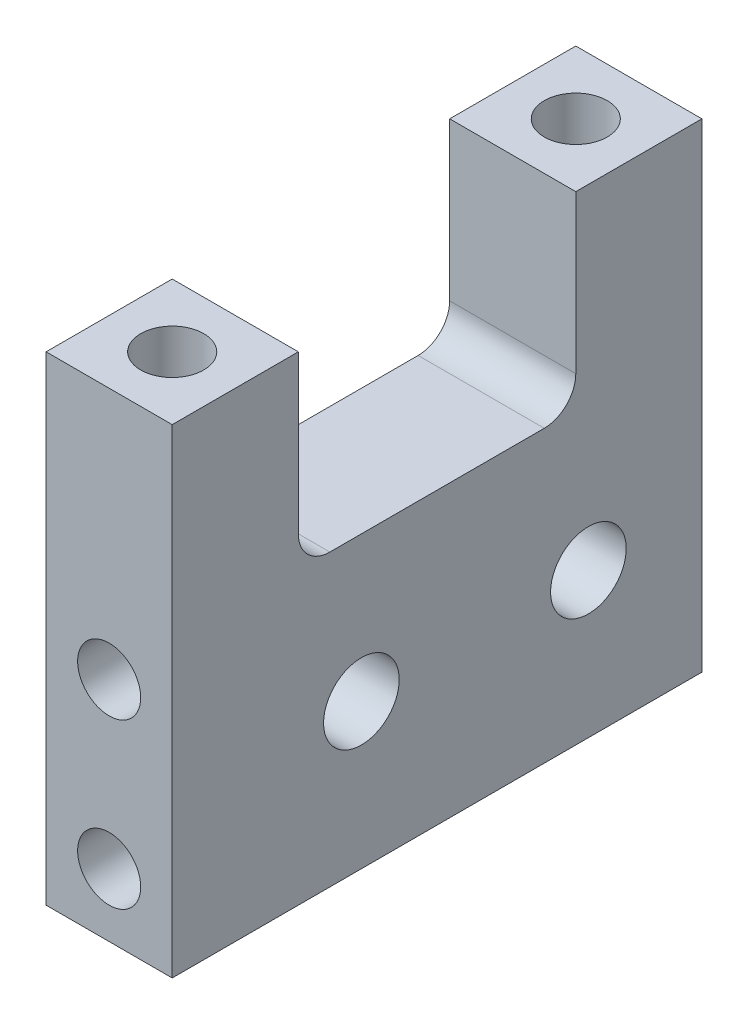
from build123d import *

# Parameters (mm, degrees)
ESQUISSE1_W           = 42
ESQUISSE1_H           = 38
EXTRUSION1_DEPTH      = 10
ESQUISSE2_R           = 2.5
EXTRUSION3_DEPTH      = 58.515215378
EXTRUSION4_REACH      = 59.515
EXTRUSION4_END_RADIUS = 2.5
ESQUISSE4_R           = 2.5
EXTRUSION5_DEPTH      = 58.515215378
ESQUISSE6_R           = 3
EXTRUSION6_DEPTH      = 58.515215378


with BuildPart() as part:
    # Esquisse1 → Extrusion1 (new body)
    with BuildSketch(Plane(origin=(0, 0, 0), x_dir=(0, 0, -1), z_dir=(1, 0, 0))):
        with Locations((21, 19)):
            Rectangle(ESQUISSE1_W, ESQUISSE1_H)
    extrude(amount=EXTRUSION1_DEPTH)

    # Esquisse2 → Extrusion3 (cut, through all)
    with BuildSketch(Plane.XY):
        with Locations((5, 5)):
            Circle(ESQUISSE2_R)
        with Locations((5, 18)):
            Circle(ESQUISSE2_R)
    extrude(amount=-EXTRUSION3_DEPTH, mode=Mode.SUBTRACT)

    # Extrusion4: up to this cylinder (the profile starts outside it)
    extrusion4_end = Plane(origin=(5, 18, -21), z_dir=(0, 0, 1)) * Cylinder(EXTRUSION4_END_RADIUS, 157.03, mode=Mode.PRIVATE)
    # Esquisse4 → Extrusion4 (cut, up to the surface)
    with BuildSketch(Plane(origin=(0, 38, 0), x_dir=(1, 0, 0), z_dir=(0, 1, 0)), mode=Mode.PRIVATE) as extrusion4_sk1:
        with Locations(Location((5, 5, 0), (0, 0, 270))):
            Circle(ESQUISSE4_R)
    extrusion4_tool1 = extrude(extrusion4_sk1.sketch, amount=-EXTRUSION4_REACH, mode=Mode.PRIVATE) - extrusion4_end
    add(extrusion4_tool1.solids().sort_by_distance((5, 38, -5))[0], mode=Mode.SUBTRACT)
    # Esquisse4 → Extrusion4 (cut, up to the surface)
    with BuildSketch(Plane(origin=(0, 38, 0), x_dir=(1, 0, 0), z_dir=(0, 1, 0)), mode=Mode.PRIVATE) as extrusion4_sk2:
        with Locations(Location((5, 37, 0), (0, 0, 270))):
            Circle(ESQUISSE4_R)
    extrusion4_tool2 = extrude(extrusion4_sk2.sketch, amount=-EXTRUSION4_REACH, mode=Mode.PRIVATE) - extrusion4_end
    add(extrusion4_tool2.solids().sort_by_distance((5, 38, -37))[0], mode=Mode.SUBTRACT)

    # Esquisse5 → Extrusion5 (cut, through all)
    with BuildSketch(Plane.ZY):
        with BuildLine():
            Line((-32, 40.062963014), (-10, 40.062963014))
            Line((-10, 40.062963014), (-10, 25.5))
            ThreePointArc((-10, 25.5), (-10.732233047, 23.732233047), (-12.5, 23))
            Line((-12.5, 23), (-29.5, 23))
            ThreePointArc((-29.5, 23), (-31.267766953, 23.732233047), (-32, 25.5))
            Line((-32, 25.5), (-32, 40.062963014))
        make_face()
    extrude(amount=-EXTRUSION5_DEPTH, mode=Mode.SUBTRACT)

    # Esquisse6 → Extrusion6 (cut, through all)
    with BuildSketch(Plane.ZY):
        with Locations((-33, 11.5)):
            Circle(ESQUISSE6_R)
        with Locations((-15, 11.5)):
            Circle(ESQUISSE6_R)
    extrude(amount=-EXTRUSION6_DEPTH, mode=Mode.SUBTRACT)


solid = part.part
